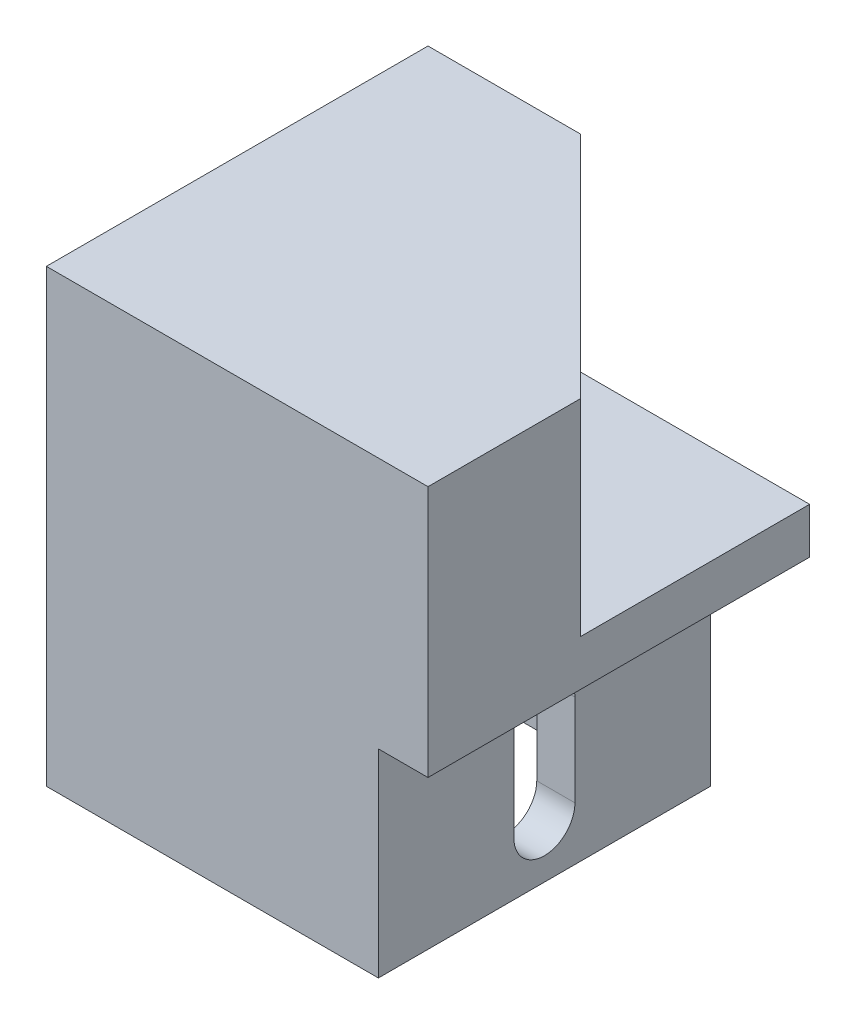
from build123d import *

# Parameters (mm, degrees)
SALIENTE_EXTRUIR1_DEPTH = 5.75
CROQUIS2_W              = 25
CROQUIS2_H              = 25
SALIENTE_EXTRUIR2_DEPTH = 3
CROQUIS3_W              = 21.75
CROQUIS3_H              = 21.75
CROQUIS3_W_2            = 13.5
CROQUIS3_H_2            = 13.5
SALIENTE_EXTRUIR3_DEPTH = 13
CORTAR_EXTRUIR1_DEPTH   = 13
CORTAR_EXTRUIR2_DEPTH   = 13
SALIENTE_EXTRUIR4_DEPTH = 2


with BuildPart() as part:
    # Croquis1 → Saliente-Extruir1 (new, symmetric)
    with BuildSketch(Plane(origin=(0, 0, 0), x_dir=(1, 0, 0), z_dir=(0, 1, 0))):
        Polygon((0, 0), (15, 0), (15, -10), (-10, -10), (-10, 15), (0, 15), align=None)
    extrude(amount=SALIENTE_EXTRUIR1_DEPTH, both=True)

    # Croquis2 → Saliente-Extruir2 (add)
    with BuildSketch(Plane.XZ.offset(5.75)):
        with Locations((2.5, -2.5)):
            Rectangle(CROQUIS2_W, CROQUIS2_H)
    extrude(amount=SALIENTE_EXTRUIR2_DEPTH)

    # Croquis3 → Saliente-Extruir3 (add)
    with BuildSketch(Plane.XZ.offset(8.75)):
        with Locations((0.875, -0.875)):
            Rectangle(CROQUIS3_W, CROQUIS3_H)
        with Locations((2.5, -2.5)):
            Rectangle(CROQUIS3_W_2, CROQUIS3_H_2, mode=Mode.SUBTRACT)
    extrude(amount=SALIENTE_EXTRUIR3_DEPTH)

    # Croquis4 → Cortar-Extruir1 (cut)
    with BuildSketch(Plane(origin=(11.75, 0, 0), x_dir=(0, 0, -1), z_dir=(1, 0, 0))):
        with BuildLine():
            Line((-1.125, -12.25), (-1.125, -18.25))
            ThreePointArc((-1.125, -18.25), (0.875, -20.25), (2.875, -18.25))
            Line((2.875, -18.25), (2.875, -12.25))
            ThreePointArc((2.875, -12.25), (0.875, -10.25), (-1.125, -12.25))
        make_face()
    extrude(amount=-CORTAR_EXTRUIR1_DEPTH, mode=Mode.SUBTRACT)

    # Croquis6 → Cortar-Extruir2 (cut)
    with BuildSketch(Plane(origin=(0, 0, -11.75), x_dir=(-1, 0, 0), z_dir=(0, 0, -1))):
        with BuildLine():
            Line((1.125, -12.25), (1.125, -18.25))
            ThreePointArc((1.125, -18.25), (-0.875, -20.25), (-2.875, -18.25))
            Line((-2.875, -18.25), (-2.875, -12.25))
            ThreePointArc((-2.875, -12.25), (-0.875, -10.25), (1.125, -12.25))
        make_face()
    extrude(amount=-CORTAR_EXTRUIR2_DEPTH, mode=Mode.SUBTRACT)

    # Croquis7 → Saliente-Extruir4 (add)
    with BuildSketch(Plane(origin=(0, 5.75, 0), x_dir=(1, 0, 0), z_dir=(0, 1, 0))):
        Polygon((15, 0), (0, 15), (0, 0), align=None)
        Polygon((15, 0), (0, 0), (0, 15), (-10, 15), (-10, -10), (15, -10), align=None)
    extrude(amount=SALIENTE_EXTRUIR4_DEPTH)


solid = part.part
